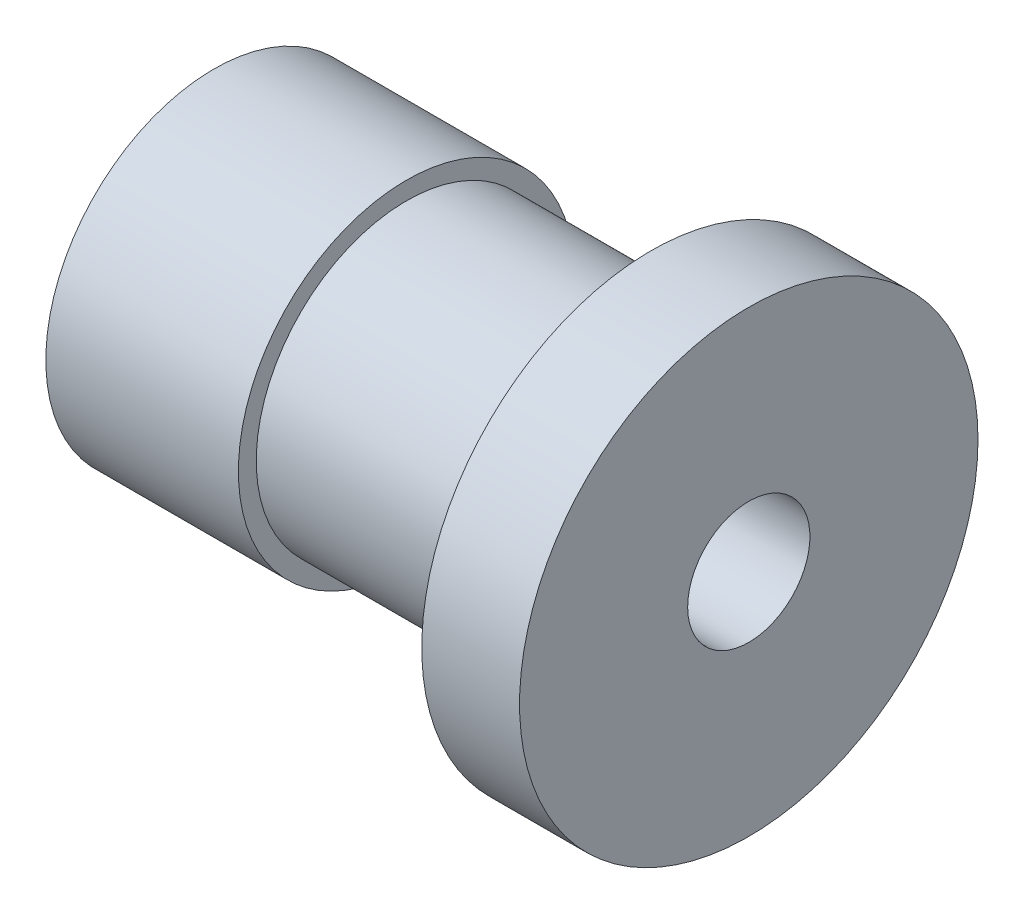
from build123d import *

# Parameters (mm, degrees)
SKETCH1_R           = 5.5
BOSS_EXTRUDE1_DEPTH = 6.3
SKETCH2_R           = 4.915
BOSS_EXTRUDE2_DEPTH = 8
SKETCH3_R           = 7.5
BOSS_EXTRUDE3_DEPTH = 3.2
SKETCH5_R           = 2
CUT_EXTRUDE1_DEPTH  = 21.46338193


with BuildPart() as part:
    # Sketch1 → Boss-Extrude1 (new body)
    with BuildSketch(Plane(origin=(0, 0, 0), x_dir=(0, 0, -1), z_dir=(1, 0, 0))):
        Circle(SKETCH1_R)
    extrude(amount=BOSS_EXTRUDE1_DEPTH)

    # Sketch2 → Boss-Extrude2 (add)
    with BuildSketch(Plane(origin=(6.3, 0, 0), x_dir=(0, 0, -1), z_dir=(1, 0, 0))):
        Circle(SKETCH2_R)
    extrude(amount=BOSS_EXTRUDE2_DEPTH)

    # Sketch3 → Boss-Extrude3 (add)
    with BuildSketch(Plane(origin=(14.3, 0, 0), x_dir=(0, 0, -1), z_dir=(1, 0, 0))):
        Circle(SKETCH3_R)
    extrude(amount=BOSS_EXTRUDE3_DEPTH)

    # Sketch5 → Cut-Extrude1 (cut, through all)
    with BuildSketch(Plane.ZY):
        Circle(SKETCH5_R)
    extrude(amount=-CUT_EXTRUDE1_DEPTH, mode=Mode.SUBTRACT)


solid = part.part
